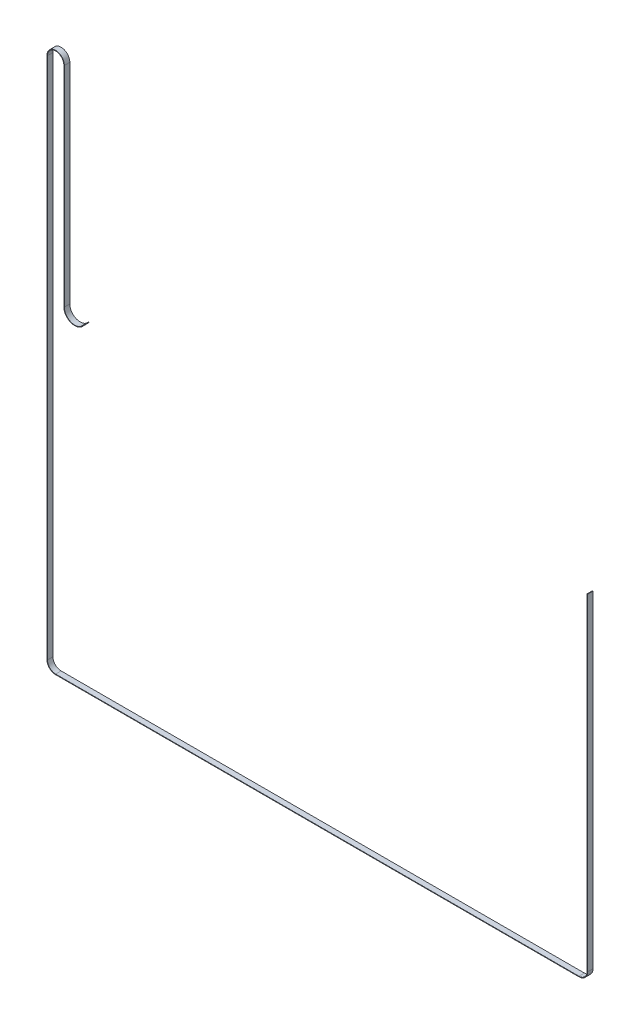
from build123d import *

# Parameters (mm, degrees)
LINEAR_AUSTRAGEN_D_NN1_DEPTH = 2.5


with BuildPart() as part:
    # Skizze1 → Linear-Austragen-Dünn1 (new, symmetric)
    with BuildSketch(Plane.XY):
        with BuildLine():
            Line((247.5, 300), (247.5, 0))
            ThreePointArc((247.5, 0), (245.303300859, -5.303300859), (240, -7.5))
            Line((240, -7.5), (-240, -7.5))
            ThreePointArc((-240, -7.5), (-245.303300859, -5.303300859), (-247.5, 0))
            Line((-247.5, 0), (-247.5, 480))
            ThreePointArc((-247.5, 480), (-240, 487.5), (-232.5, 480))
            Line((-232.5, 480), (-232.5, 288))
            ThreePointArc((-232.5, 288), (-225.612554872, 278.496737288), (-214.437599567, 282.084114669))
            Line((-214.437599567, 282.084114669), (-214.840719588, 282.379908935))
            ThreePointArc((-214.840719588, 282.379908935), (-225.456927129, 278.971900424), (-232, 288))
            Line((-232, 288), (-232, 480))
            ThreePointArc((-232, 480), (-240, 488), (-248, 480))
            Line((-248, 480), (-248, 0))
            ThreePointArc((-248, 0), (-245.656854249, -5.656854249), (-240, -8))
            Line((-240, -8), (240, -8))
            ThreePointArc((240, -8), (245.656854249, -5.656854249), (248, 0))
            Line((248, 0), (248, 300))
            Line((248, 300), (247.5, 300))
        make_face()
    extrude(amount=LINEAR_AUSTRAGEN_D_NN1_DEPTH, both=True)


solid = part.part
